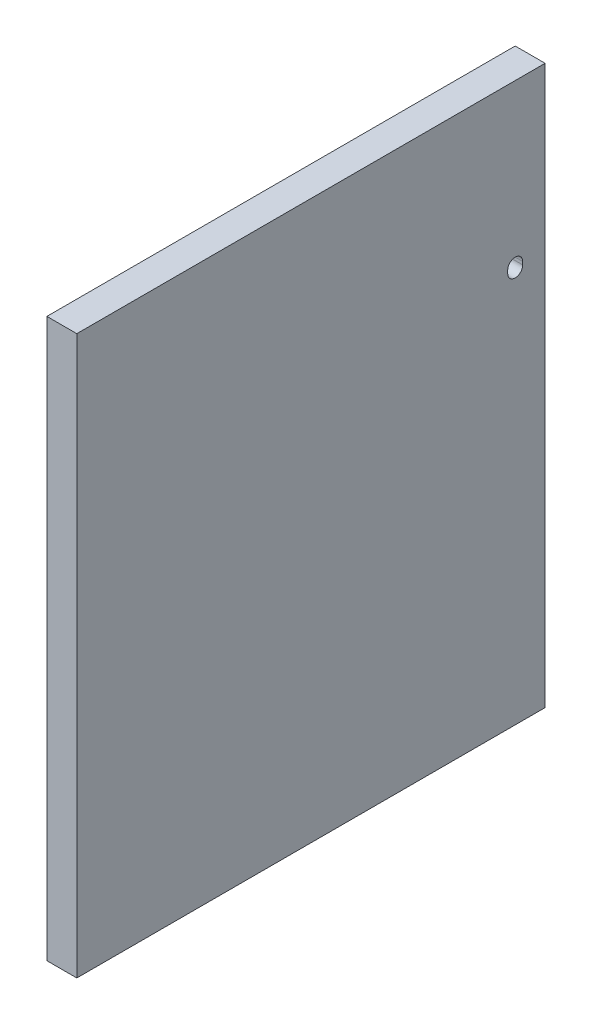
from build123d import *

# Parameters (mm, degrees)
SKETCH1_W           = 198.761009384
SKETCH1_H           = 236.83336565
BOSS_EXTRUDE1_DEPTH = 12.7
CUT_EXTRUDE1_DEPTH  = 12.7
FILLET1_R           = 3


with BuildPart() as part:
    # Sketch1 → Boss-Extrude1 (new body)
    with BuildSketch(Plane(origin=(0, 0, 0), x_dir=(0, 0, -1), z_dir=(1, 0, 0))):
        with Locations((-50.223991022, -49.693394246)):
            Rectangle(SKETCH1_W, SKETCH1_H)
    extrude(amount=BOSS_EXTRUDE1_DEPTH)

    # Sketch2 → Cut-Extrude1 (cut)
    with BuildSketch(Plane.ZY):
        with BuildLine():
            Line((-33.28151367, 0.635), (-33.28151367, -0.635))
            ThreePointArc((-33.28151367, -0.635), (-36.45651367, -3.81), (-39.63151367, -0.635))
            Line((-39.63151367, -0.635), (-39.63151367, 0.635))
            ThreePointArc((-39.63151367, 0.635), (-36.45651367, 3.81), (-33.28151367, 0.635))
        make_face()
    extrude(amount=-CUT_EXTRUDE1_DEPTH, mode=Mode.SUBTRACT)

    # Fillet1
    fillet1_edges = [part.edges().sort_by_distance(p)[0] for p in [
        (0, 3.81, -36.45651367),
        (0, 0, -39.63151367),
        (0, -3.81, -36.45651367),
        (0, 0, -33.28151367),
    ]]
    fillet(fillet1_edges, radius=FILLET1_R)


solid = part.part
